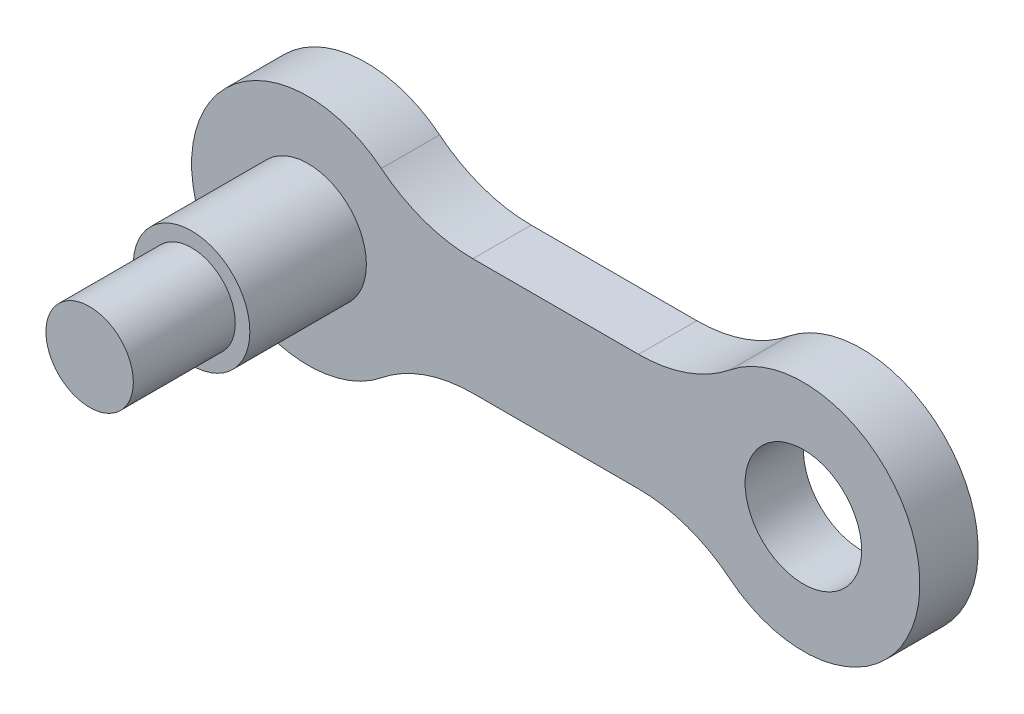
from build123d import *

# Parameters (mm, degrees)
SKETCH1_R           = 2
BOSS_EXTRUDE1_DEPTH = 2
SKETCH2_R           = 2
SKETCH2_R_2         = 1.5
BOSS_EXTRUDE2_DEPTH = 4
SKETCH3_R           = 1.5
BOSS_EXTRUDE3_DEPTH = 3.5


with BuildPart() as part:
    # Sketch1 → Boss-Extrude1 (new body)
    with BuildSketch(Plane.XY):
        with BuildLine():
            ThreePointArc((5.656854249, -2), (3.990187583, -2.285954792), (2.514157444, -3.111111111))
            ThreePointArc((2.514157444, -3.111111111), (-4, 0), (2.514157444, 3.111111111))
            ThreePointArc((2.514157444, 3.111111111), (3.990187583, 2.285954792), (5.656854249, 2))
            Line((5.656854249, 2), (11.343145751, 2))
            ThreePointArc((11.343145751, 2), (13.009812417, 2.285954792), (14.485842556, 3.111111111))
            ThreePointArc((14.485842556, 3.111111111), (21, 0), (14.485842556, -3.111111111))
            ThreePointArc((14.485842556, -3.111111111), (13.009812417, -2.285954792), (11.343145751, -2))
            Line((11.343145751, -2), (5.656854249, -2))
        make_face()
        with Locations((17, 0)):
            Circle(SKETCH1_R, mode=Mode.SUBTRACT)
        Circle(SKETCH1_R, mode=Mode.SUBTRACT)
    extrude(amount=BOSS_EXTRUDE1_DEPTH)


with BuildPart() as body_2:
    # Sketch2 → Boss-Extrude2 (new body)
    with BuildSketch(Plane.XY.offset(2)):
        Circle(SKETCH2_R)
        Circle(SKETCH2_R_2, mode=Mode.SUBTRACT)
    extrude(amount=BOSS_EXTRUDE2_DEPTH)


with BuildPart() as body_3:
    # Sketch3 → Boss-Extrude3 (new body)
    with BuildSketch(Plane.XY.offset(6)):
        Circle(SKETCH3_R)
    extrude(amount=BOSS_EXTRUDE3_DEPTH)


solid = Compound([part.part, body_2.part, body_3.part])
